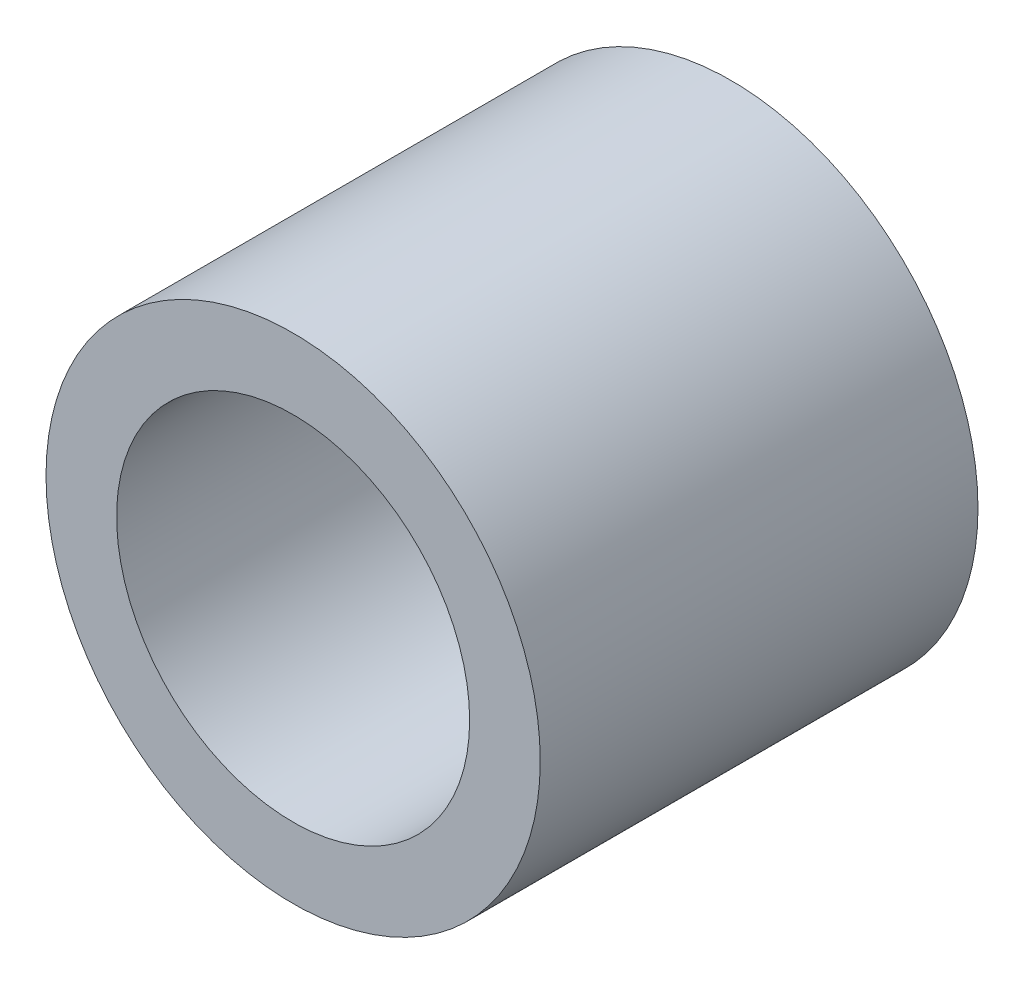
from build123d import *

# Parameters (mm, degrees)
SKETCH2_R           = 17.5
SKETCH2_R_2         = 12.5
BOSS_EXTRUDE1_DEPTH = 31


with BuildPart() as part:
    # Sketch2 → Boss-Extrude1 (new body)
    with BuildSketch(Plane.XY):
        Circle(SKETCH2_R)
        Circle(SKETCH2_R_2, mode=Mode.SUBTRACT)
    extrude(amount=BOSS_EXTRUDE1_DEPTH)


solid = part.part
